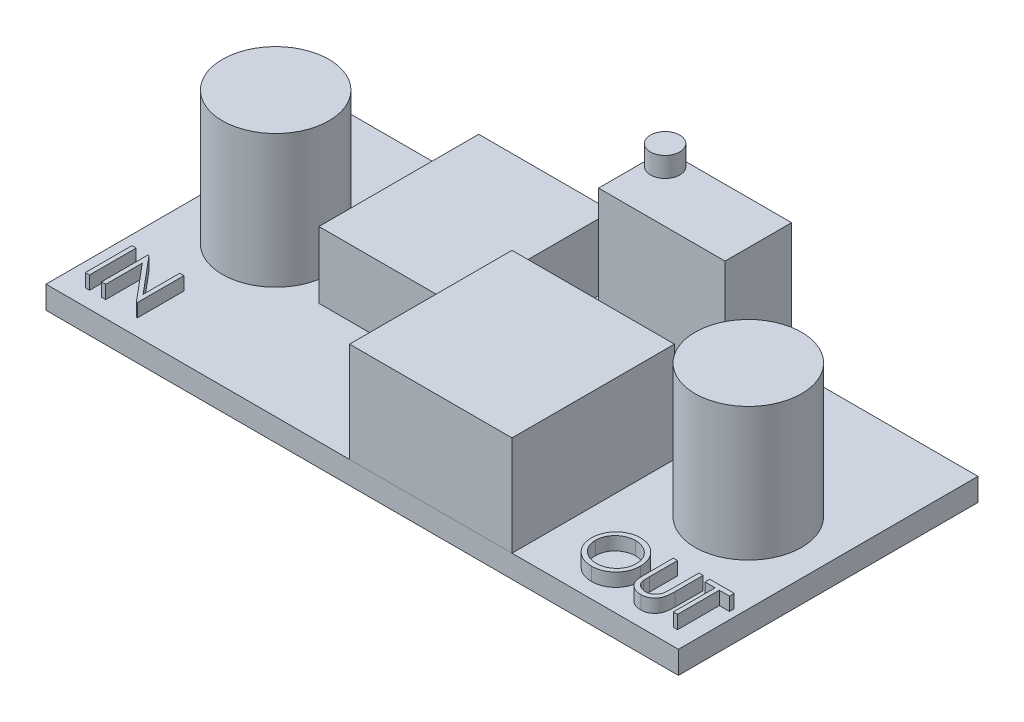
from build123d import *

# Parameters (mm, degrees)
SKETCH1_W             = 47.5
SKETCH1_H             = 22.5
BOSS_EXTRUDE1_DEPTH   = 1.7
SKETCH2_R             = 4
BOSS_EXTRUDE2_DEPTH   = 10
BOSS_EXTRUDE2_2_DEPTH = 10
SKETCH3_W             = 12.2
SKETCH3_H             = 12.2
BOSS_EXTRUDE3_DEPTH   = 7.5
SKETCH3_3_W           = 9.5
SKETCH3_3_H           = 5
BOSS_EXTRUDE4_DEPTH   = 10.5
SKETCH3_4_W           = 10
SKETCH3_4_H           = 12
BOSS_EXTRUDE5_DEPTH   = 5
SKETCH4_W             = 0.314102564
SKETCH4_H             = 3.5
BOSS_EXTRUDE6_DEPTH   = 1
SKETCH5_R             = 1.1
BOSS_EXTRUDE7_DEPTH   = 1.5


with BuildPart() as part:
    # Sketch1 → Boss-Extrude1 (new body)
    with BuildSketch(Plane(origin=(0, 0, 0), x_dir=(1, 0, 0), z_dir=(0, 1, 0))):
        Rectangle(SKETCH1_W, SKETCH1_H)
    extrude(amount=BOSS_EXTRUDE1_DEPTH)

    # Sketch4 → Boss-Extrude6 (add)
    # profile 1 of 5: a face of its own
    with BuildSketch(Plane(origin=(0, 1.7, 0), x_dir=(1, 0, 0), z_dir=(0, 1, 0))):
        with Locations((-21.870246323, -8.264510776)):
            Rectangle(SKETCH4_W, SKETCH4_H)
    # profile 2 of 5: a face of its own
    with BuildSketch(Plane(origin=(0, 1.7, 0), x_dir=(1, 0, 0), z_dir=(0, 1, 0))):
        Polygon((-20.815759143, -10.014510776), (-20.815759143, -6.514510776), (-20.749853695, -6.514510776), (-18.437554015, -9.269218308), (-18.437554015, -6.514510776), (-18.123451451, -6.514510776), (-18.123451451, -10.014510776), (-18.194965874, -10.014510776), (-20.501656579, -7.26611334), (-20.501656579, -10.014510776), align=None)
    # profile 3 of 5: a face of its own
    with BuildSketch(Plane(origin=(0, 1.7, 0), x_dir=(1, 0, 0), z_dir=(0, 1, 0))):
        with BuildLine():
            add(Edge.make_bspline(
                [(16.048695094, -6.424767186), (16.113503199, -6.426408665), (16.240791666, -6.429632666), (16.427866564, -6.45431177), (16.606461659, -6.49700716), (16.778031798, -6.553870142), (16.940524775, -6.629724528), (17.095163667, -6.721409676), (17.241580541, -6.829886135), (17.377801923, -6.954315362), (17.502458873, -7.089698816), (17.612284759, -7.234176726), (17.704327053, -7.386875528), (17.77991284, -7.547336359), (17.83921145, -7.715196327), (17.880130493, -7.891350329), (17.906268644, -8.074657019), (17.909324421, -8.199683884), (17.910874581, -8.263108532)],
                knots=[0, 0, 0, 0, 1.065120563, 2.091984664, 3.0946048, 4.079830382, 5.057816894, 6.036188127, 7.030412546, 8.04752943, 9.064399622, 10.05169764, 11.02544977, 11.989514704, 12.962713494, 13.945757189, 14.957906945, 16, 16, 16, 16], degree=3))
            add(Edge.make_bspline(
                [(17.910874581, -8.263108532), (17.909324648, -8.326065979), (17.906269552, -8.450162399), (17.880100774, -8.632305843), (17.839059774, -8.80739654), (17.780463508, -8.975142192), (17.705238029, -9.135719756), (17.612582858, -9.28870671), (17.503441648, -9.434153208), (17.379234797, -9.570465874), (17.243833755, -9.695463344), (17.098603488, -9.80438222), (16.946810168, -9.898106345), (16.78650046, -9.972890019), (16.619800423, -10.032661939), (16.4452181, -10.073414569), (16.263571546, -10.099701612), (16.139700542, -10.102720128), (16.076739965, -10.104254366)],
                knots=[0, 0, 0, 0, 1.043624062, 2.057103931, 3.04512605, 4.022047818, 4.998200453, 5.980619268, 6.982898556, 8.009068085, 9.034988726, 10.034168286, 11.015286542, 11.987931943, 12.962482838, 13.94673481, 14.956375938, 16, 16, 16, 16], degree=3))
            add(Edge.make_bspline(
                [(16.076739965, -10.104254366), (16.013315646, -10.102704979), (15.88828943, -10.099650725), (15.704752395, -10.07346932), (15.528474651, -10.032528016), (15.3599603, -9.97401858), (15.19911537, -9.898401349), (15.045625288, -9.80619697), (14.90010614, -9.696789829), (14.763764394, -9.572623254), (14.639015196, -9.437451702), (14.53025582, -9.292617447), (14.438030707, -9.140961991), (14.362667374, -8.982064467), (14.303002915, -8.816693024), (14.262298097, -8.643744546), (14.235962145, -8.464205041), (14.232927298, -8.341962142), (14.231387401, -8.279935455)],
                knots=[0, 0, 0, 0, 1.053102029, 2.075944431, 3.073151272, 4.055350789, 5.033113405, 6.020478099, 7.024410459, 8.052272461, 9.079885166, 10.07527673, 11.055994387, 12.023226415, 12.992069828, 13.970394897, 14.97016774, 16, 16, 16, 16], degree=3))
            add(Edge.make_bspline(
                [(14.231387401, -8.279935455), (14.231922037, -8.238302786), (14.232984563, -8.155562663), (14.245776256, -8.032696062), (14.264337957, -7.911805405), (14.290939869, -7.793234457), (14.325731536, -7.677273472), (14.366783564, -7.563122709), (14.416923409, -7.451938985), (14.473604057, -7.343195594), (14.536865865, -7.238587688), (14.606741615, -7.139708105), (14.680776983, -7.045727108), (14.761940377, -6.959080104), (14.847556822, -6.877246448), (14.9390152, -6.801483731), (15.035757444, -6.73110878), (15.138199824, -6.667688439), (15.243818099, -6.610329304), (15.352694877, -6.561107453), (15.463351448, -6.518861392), (15.576306096, -6.484620566), (15.691258868, -6.45758853), (15.808460653, -6.439181177), (15.927818079, -6.426356859), (16.008229398, -6.425299357), (16.048695094, -6.424767186)],
                knots=[0, 0, 0, 0, 1.037015668, 2.060948919, 3.074880161, 4.083647147, 5.086022904, 6.090072063, 7.104153813, 8.122640571, 9.144368836, 10.147691507, 11.138137339, 12.123020368, 13.103399296, 14.087645067, 15.080126199, 16.082011238, 17.087798457, 18.072939717, 19.057185487, 20.037253025, 21.01195951, 21.997135196, 22.992090687, 24, 24, 24, 24], degree=3))
        make_face()
        with BuildLine():
            add(Edge.make_bspline(
                [(16.064119773, -6.783741545), (16.030905139, -6.784146435), (15.964793407, -6.784952345), (15.86650887, -6.795568061), (15.769516936, -6.81069795), (15.673797574, -6.83227947), (15.579751285, -6.861683523), (15.486501444, -6.895524431), (15.39489839, -6.936745522), (15.305244532, -6.983318226), (15.218329457, -7.034867147), (15.136316755, -7.091838914), (15.058994111, -7.152897468), (14.986550845, -7.218185306), (14.919199673, -7.288034907), (14.855614971, -7.361387344), (14.798345389, -7.440339235), (14.745859813, -7.522749642), (14.698891972, -7.608511223), (14.657126618, -7.696721085), (14.622962609, -7.788098772), (14.595100233, -7.881652929), (14.572000422, -7.977235389), (14.557366498, -8.075571238), (14.546634138, -8.17616635), (14.545874293, -8.244148204), (14.545489965, -8.278533212)],
                knots=[0, 0, 0, 0, 1.008559885, 2.007477868, 2.99961109, 3.989939068, 4.984837346, 5.991145699, 7.001802488, 8.033829008, 9.059044045, 10.069351652, 11.065060232, 12.050310815, 13.029377138, 14.011219647, 14.996725999, 15.989392538, 16.977580475, 17.965360261, 18.951710183, 19.937753436, 20.929683414, 21.935841486, 22.955955122, 24, 24, 24, 24], degree=3))
            add(Edge.make_bspline(
                [(14.545489965, -8.278533212), (14.546764827, -8.329095432), (14.549272875, -8.428566963), (14.571230445, -8.574335107), (14.60505242, -8.714423393), (14.654909786, -8.848065302), (14.717260401, -8.976409585), (14.794287291, -9.09831769), (14.885546377, -9.213822564), (14.989209903, -9.322117833), (15.10253261, -9.420963637), (15.22286534, -9.507727046), (15.348918947, -9.581137296), (15.48102215, -9.640942368), (15.618469689, -9.688332106), (15.76214724, -9.720810737), (15.9110977, -9.742186193), (16.012628355, -9.744238948), (16.064119773, -9.745280007)],
                knots=[0, 0, 0, 0, 1.032063989, 2.030389145, 3.003944642, 3.970395727, 4.937377036, 5.913328081, 6.909231446, 7.93887556, 8.970685674, 9.976071282, 10.964166581, 11.944589148, 12.933237628, 13.927779006, 14.949070134, 16, 16, 16, 16], degree=3))
            add(Edge.make_bspline(
                [(16.064119773, -9.745280007), (16.098729275, -9.744804502), (16.167370311, -9.743861434), (16.269465833, -9.734362757), (16.369722045, -9.719130888), (16.467998325, -9.697200232), (16.564183136, -9.669753026), (16.658677939, -9.637145298), (16.75047623, -9.596464094), (16.840736068, -9.551516143), (16.927132309, -9.500275985), (17.009607842, -9.445237836), (17.086083821, -9.384269215), (17.158472893, -9.319951402), (17.226100582, -9.250987554), (17.288509566, -9.177467333), (17.345489698, -9.098926675), (17.397955345, -9.01664127), (17.444758608, -8.930645017), (17.485537707, -8.842115339), (17.520133822, -8.75127023), (17.548062327, -8.657978658), (17.569947789, -8.562417809), (17.585027709, -8.464459731), (17.595576148, -8.364300389), (17.596371225, -8.296556533), (17.596772017, -8.26240741)],
                knots=[0, 0, 0, 0, 1.047197238, 2.076906641, 3.100256066, 4.114471768, 5.12198147, 6.126382909, 7.136867548, 8.15857795, 9.17633901, 10.174870724, 11.156907918, 12.133735059, 13.104061851, 14.077631395, 15.04955518, 16.038496417, 17.029181396, 18.010275684, 18.986308667, 19.968651475, 20.955262928, 21.950658345, 22.966943676, 24, 24, 24, 24], degree=3))
            add(Edge.make_bspline(
                [(17.596772017, -8.26240741), (17.596370904, -8.228491906), (17.595575222, -8.161214256), (17.585032747, -8.061753438), (17.569931857, -7.964500226), (17.548169149, -7.869836423), (17.520118995, -7.777737898), (17.485531665, -7.68829115), (17.444746365, -7.601162955), (17.397938141, -7.516568658), (17.345322318, -7.43539392), (17.287828074, -7.357791508), (17.224462726, -7.285218766), (17.157036701, -7.215884072), (17.083865816, -7.151266183), (17.005281522, -7.091343662), (16.922237844, -7.034670388), (16.834310609, -6.983544826), (16.743566655, -6.936330593), (16.650452697, -6.89587959), (16.556023597, -6.861507471), (16.460519485, -6.832190506), (16.363136507, -6.810782476), (16.264532678, -6.795554426), (16.164844419, -6.78495604), (16.0978012, -6.784147661), (16.064119773, -6.783741545)],
                knots=[0, 0, 0, 0, 1.02996197, 2.043119294, 3.035359645, 4.018872909, 4.991431989, 5.957985074, 6.929999688, 7.912076566, 8.892894881, 9.867085534, 10.843653904, 11.817741046, 12.803660682, 13.806313499, 14.818574707, 15.856120519, 16.894564902, 17.924820532, 18.937903209, 19.946497019, 20.957711757, 21.963978472, 22.977135795, 24, 24, 24, 24], degree=3))
        make_face(mode=Mode.SUBTRACT)
    # profile 4 of 5: a face of its own
    with BuildSketch(Plane(origin=(0, 1.7, 0), x_dir=(1, 0, 0), z_dir=(0, 1, 0))):
        with BuildLine():
            Line((18.628823299, -6.514510776), (18.942925863, -6.514510776))
            Line((18.942925863, -6.514510776), (18.942925863, -8.611566064))
            add(Edge.make_bspline(
                [(18.942925863, -8.611566064), (18.942879119, -8.6412468), (18.942790414, -8.697571111), (18.943382928, -8.777739411), (18.945042296, -8.849011871), (18.946088456, -8.911663218), (18.948415789, -8.965405966), (18.950313836, -9.010531276), (18.952754393, -9.046825479), (18.955687511, -9.068006405), (18.956948299, -9.077110936)],
                knots=[0, 0, 0, 0, 1.528628734, 2.90083645, 4.128790002, 5.200304208, 6.127813768, 6.898992206, 7.526736466, 8, 8, 8, 8], degree=3))
            add(Edge.make_bspline(
                [(18.956948299, -9.077110936), (18.962125757, -9.109957699), (18.972188944, -9.173800429), (18.997835322, -9.26470871), (19.033652823, -9.346640169), (19.076095865, -9.42215146), (19.132028477, -9.48914082), (19.199032012, -9.550852473), (19.28020978, -9.604824277), (19.370470386, -9.654175089), (19.467755624, -9.693840171), (19.56716689, -9.723833536), (19.667209869, -9.742112436), (19.734186034, -9.744228975), (19.767445094, -9.745280007)],
                knots=[0, 0, 0, 0, 1.035780045, 2.013197591, 2.933192213, 3.817615948, 4.702609284, 5.640816605, 6.646850145, 7.73207398, 8.84249596, 9.914020372, 10.964143139, 12, 12, 12, 12], degree=3))
            add(Edge.make_bspline(
                [(19.767445094, -9.745280007), (19.795998834, -9.744206156), (19.852941396, -9.742064658), (19.937547826, -9.728803227), (20.019947935, -9.704902661), (20.100548615, -9.674062903), (20.176099599, -9.633315312), (20.246643041, -9.586244472), (20.309606976, -9.531033596), (20.367064974, -9.469933252), (20.417099909, -9.400993452), (20.460471051, -9.325715314), (20.495996981, -9.242965967), (20.513540505, -9.184811545), (20.522553267, -9.154935455)],
                knots=[0, 0, 0, 0, 0.994687771, 1.983630487, 2.973142513, 3.978332533, 4.983357753, 5.956394766, 6.925816176, 7.893390482, 8.871859704, 9.88551698, 10.913711441, 12, 12, 12, 12], degree=3))
            add(Edge.make_bspline(
                [(20.522553267, -9.154935455), (20.525553392, -9.142586881), (20.53223888, -9.115069281), (20.538485925, -9.06854799), (20.54499245, -9.013658626), (20.54950702, -8.950006814), (20.553908241, -8.877805841), (20.556541314, -8.796679583), (20.557758347, -8.706922623), (20.558121027, -8.644285461), (20.558310478, -8.611566064)],
                knots=[0, 0, 0, 0, 0.558680831, 1.244966039, 2.062412453, 2.990489873, 4.051219941, 5.244515665, 6.560634259, 8, 8, 8, 8], degree=3))
            Line((20.558310478, -8.611566064), (20.558310478, -6.514510776))
            Line((20.558310478, -6.514510776), (20.872413042, -6.514510776))
            Line((20.872413042, -6.514510776), (20.872413042, -8.628392987))
            add(Edge.make_bspline(
                [(20.872413042, -8.628392987), (20.872158922, -8.666491366), (20.87166299, -8.740842669), (20.867362414, -8.849794028), (20.860505414, -8.95314701), (20.850817326, -9.050915506), (20.837980323, -9.142749665), (20.823705102, -9.229454433), (20.805525569, -9.310407426), (20.784292168, -9.386239844), (20.76001862, -9.458425357), (20.728577472, -9.526933972), (20.693152972, -9.593848371), (20.651138319, -9.65815648), (20.603926936, -9.720143033), (20.550475256, -9.779432108), (20.492551095, -9.836971155), (20.429191535, -9.891284221), (20.36144101, -9.941092898), (20.289501052, -9.984890669), (20.213924282, -10.021914286), (20.134907156, -10.052390211), (20.052415953, -10.07530481), (19.966448594, -10.092379966), (19.8768094, -10.102082263), (19.815844744, -10.103524193), (19.784973138, -10.104254366)],
                knots=[0, 0, 0, 0, 1.316592851, 2.569410997, 3.76748051, 4.895814652, 5.963796859, 6.97159953, 7.931736103, 8.829262218, 9.692595152, 10.560224239, 11.431080259, 12.30701507, 13.211635791, 14.121146779, 15.063487852, 16.031507147, 17.00238618, 17.966455255, 18.938106653, 19.907068911, 20.888905087, 21.893141452, 22.933117798, 24, 24, 24, 24], degree=3))
            add(Edge.make_bspline(
                [(19.784973138, -10.104254366), (19.751304036, -10.1034696), (19.685245377, -10.101929894), (19.58790731, -10.093107143), (19.494593113, -10.076488749), (19.404317236, -10.055328805), (19.318308739, -10.026145068), (19.235415295, -9.992046943), (19.157056614, -9.950169683), (19.081961485, -9.90357629), (19.012136729, -9.851151652), (18.948039326, -9.794011478), (18.889563455, -9.7330711), (18.837694759, -9.667670735), (18.791573874, -9.598319028), (18.751843661, -9.524819788), (18.717730417, -9.447201472), (18.70012385, -9.393248271), (18.691223138, -9.365973116)],
                knots=[0, 0, 0, 0, 1.13879206, 2.234305948, 3.301075583, 4.341971843, 5.366689343, 6.369221514, 7.369726634, 8.367512178, 9.355451585, 10.318319045, 11.268648973, 12.207971039, 13.137398894, 14.081662264, 15.030215811, 16, 16, 16, 16], degree=3))
            add(Edge.make_bspline(
                [(18.691223138, -9.365973116), (18.68604598, -9.347340541), (18.674816609, -9.306926072), (18.662791311, -9.240039584), (18.65268223, -9.163024666), (18.643176671, -9.075876048), (18.637567713, -8.978526181), (18.632650275, -8.871017265), (18.628788656, -8.753219303), (18.628811428, -8.671164788), (18.628823299, -8.628392987)],
                knots=[0, 0, 0, 0, 0.625038921, 1.35572334, 2.194682327, 3.136881307, 4.189498639, 5.346923369, 6.617055217, 8, 8, 8, 8], degree=3))
            Line((18.628823299, -8.628392987), (18.628823299, -6.514510776))
        make_face()
    # profile 5 of 5: a face of its own
    with BuildSketch(Plane(origin=(0, 1.7, 0), x_dir=(1, 0, 0), z_dir=(0, 1, 0))):
        Polygon((21.366002786, -6.873485135), (21.366002786, -6.514510776), (23.205746376, -6.514510776), (23.205746376, -6.873485135), (22.442925863, -6.873485135), (22.442925863, -10.014510776), (22.128823299, -10.014510776), (22.128823299, -6.873485135), align=None)
    extrude(amount=BOSS_EXTRUDE6_DEPTH)


with BuildPart() as body_2:
    # Sketch2 → Boss-Extrude2 (new body)
    with BuildSketch(Plane(origin=(0, 1.7, 0), x_dir=(1, 0, 0), z_dir=(0, 1, 0))):
        with Locations((17.75, 0)):
            Circle(SKETCH2_R)
    extrude(amount=BOSS_EXTRUDE2_DEPTH)


with BuildPart() as body_3:
    # Sketch2 → Boss-Extrude2 2 (new body)
    with BuildSketch(Plane(origin=(0, 1.7, 0), x_dir=(1, 0, 0), z_dir=(0, 1, 0))):
        with Locations((-17.75, 0)):
            Circle(SKETCH2_R)
    extrude(amount=BOSS_EXTRUDE2_2_DEPTH)


with BuildPart() as body_4:
    # Sketch3 → Boss-Extrude3 (new body)
    with BuildSketch(Plane(origin=(0, 1.7, 0), x_dir=(1, 0, 0), z_dir=(0, 1, 0))):
        with Locations((5.15, -5.15)):
            Rectangle(SKETCH3_W, SKETCH3_H)
    extrude(amount=BOSS_EXTRUDE3_DEPTH)


with BuildPart() as body_5:
    # Sketch3<3> → Boss-Extrude4 (new body)
    with BuildSketch(Plane(origin=(0, 1.7, 0), x_dir=(1, 0, 0), z_dir=(0, 1, 0))):
        with Locations((6, 7.75)):
            Rectangle(SKETCH3_3_W, SKETCH3_3_H)
    extrude(amount=BOSS_EXTRUDE4_DEPTH)

    # Sketch5 → Boss-Extrude7 (add)
    with BuildSketch(Plane(origin=(0, 12.2, 0), x_dir=(1, 0, 0), z_dir=(0, 1, 0))):
        with Locations((2.35, 9.15)):
            Circle(SKETCH5_R)
    extrude(amount=BOSS_EXTRUDE7_DEPTH)


with BuildPart() as body_6:
    # Sketch3<4> → Boss-Extrude5 (new body)
    with BuildSketch(Plane(origin=(0, 1.7, 0), x_dir=(1, 0, 0), z_dir=(0, 1, 0))):
        with Locations((-7.25, 3.75)):
            Rectangle(SKETCH3_4_W, SKETCH3_4_H)
    extrude(amount=BOSS_EXTRUDE5_DEPTH)


solid = Compound([part.part, body_2.part, body_3.part, body_4.part, body_5.part, body_6.part])
